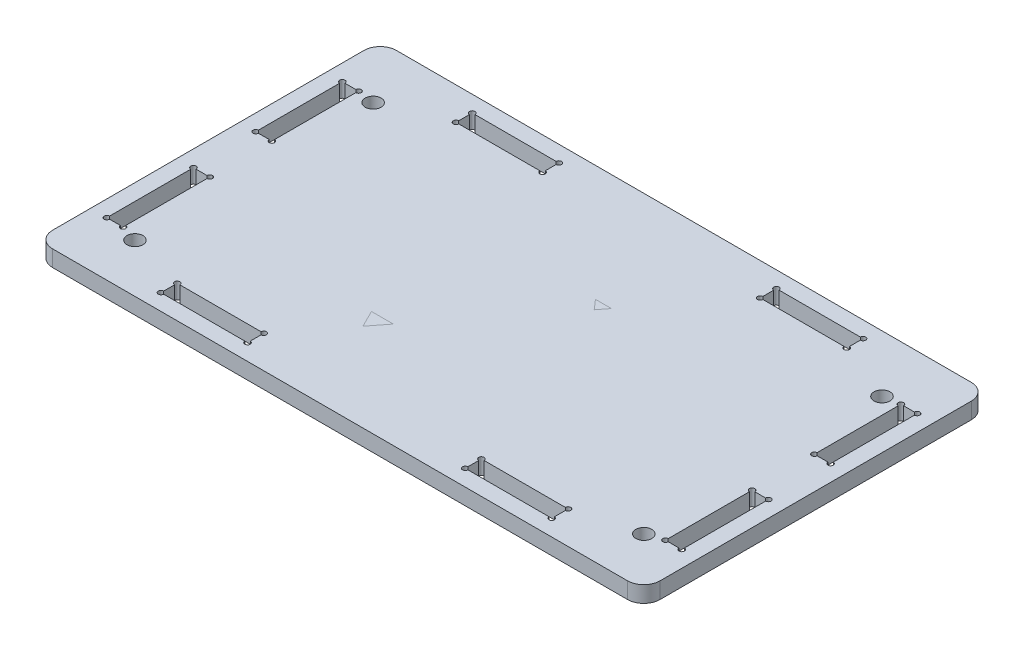
from build123d import *

# Parameters (mm, degrees)
SKETCH5_R              = 1.4732
BOSS_EXTRUDE1_DEPTH    = 3
SKETCH6_R              = 5
SKETCH6_R_2            = 3.5
BOSS_EXTRUDE2_DEPTH    = 0.2
SKETCH6_R_3            = 2
BOSS_EXTRUDE2_2_DEPTH  = 0.2
BOSS_EXTRUDE2_3_DEPTH  = 0.2
BOSS_EXTRUDE2_4_DEPTH  = 0.2
BOSS_EXTRUDE2_5_DEPTH  = 0.2
BOSS_EXTRUDE2_6_DEPTH  = 0.2
BOSS_EXTRUDE2_7_DEPTH  = 0.2
BOSS_EXTRUDE2_8_DEPTH  = 0.2
BOSS_EXTRUDE2_9_DEPTH  = 0.2
BOSS_EXTRUDE2_10_DEPTH = 0.2
BOSS_EXTRUDE2_11_DEPTH = 0.2
SKETCH6_W              = 7.5
SKETCH6_H              = 1.875
BOSS_EXTRUDE2_12_DEPTH = 0.2
BOSS_EXTRUDE2_13_DEPTH = 0.2
BOSS_EXTRUDE2_14_DEPTH = 0.2
BOSS_EXTRUDE2_15_DEPTH = 0.2
BOSS_EXTRUDE2_16_DEPTH = 0.2
BOSS_EXTRUDE2_17_DEPTH = 0.2
BOSS_EXTRUDE2_18_DEPTH = 0.2
BOSS_EXTRUDE2_19_DEPTH = 0.2
SKETCH6_H_2            = 7.5
BOSS_EXTRUDE2_20_DEPTH = 0.2


with BuildPart() as part:
    # Sketch5 → Boss-Extrude1 (new body)
    with BuildSketch(Plane(origin=(0, 0, 0), x_dir=(1, 0, 0), z_dir=(0, 1, 0))):
        with BuildLine():
            Line((-13.2, -6), (93, -6))
            ThreePointArc((93, -6), (95.121320344, -5.121320344), (96, -3))
            Line((96, -3), (96, 54.5))
            ThreePointArc((96, 54.5), (95.121320344, 56.621320344), (93, 57.5))
            Line((93, 57.5), (-13.2, 57.5))
            ThreePointArc((-13.2, 57.5), (-15.321320344, 56.621320344), (-16.2, 54.5))
            Line((-16.2, 54.5), (-16.2, -3))
            ThreePointArc((-16.2, -3), (-15.321320344, -5.121320344), (-13.2, -6))
        make_face()
        with Locations(Location((-7, 3, 0), (0, 0, 270))):
            Circle(SKETCH5_R, mode=Mode.SUBTRACT)
        with Locations(Location((-7, 47, 0), (0, 0, 270))):
            Circle(SKETCH5_R, mode=Mode.SUBTRACT)
        with Locations(Location((87, 47, 0), (0, 0, 270))):
            Circle(SKETCH5_R, mode=Mode.SUBTRACT)
        with Locations(Location((87, 3, 0), (0, 0, 270))):
            Circle(SKETCH5_R, mode=Mode.SUBTRACT)
        with BuildLine():
            Line((4.3, 54.5), (19.3, 54.5))
            ThreePointArc((19.3, 54.5), (20.153553391, 54.853553391), (19.8, 54))
            Line((19.8, 54), (19.8, 52))
            ThreePointArc((19.8, 52), (20.153553391, 51.146446609), (19.3, 51.5))
            Line((19.3, 51.5), (4.3, 51.5))
            ThreePointArc((4.3, 51.5), (3.446446609, 51.146446609), (3.8, 52))
            Line((3.8, 52), (3.8, 54))
            ThreePointArc((3.8, 54), (3.446446609, 54.853553391), (4.3, 54.5))
        make_face(mode=Mode.SUBTRACT)
        with BuildLine():
            Line((60.5, 54.5), (75.5, 54.5))
            ThreePointArc((75.5, 54.5), (76.353553391, 54.853553391), (76, 54))
            Line((76, 54), (76, 52))
            ThreePointArc((76, 52), (76.353553391, 51.146446609), (75.5, 51.5))
            Line((75.5, 51.5), (60.5, 51.5))
            ThreePointArc((60.5, 51.5), (59.646446609, 51.146446609), (60, 52))
            Line((60, 52), (60, 54))
            ThreePointArc((60, 54), (59.646446609, 54.853553391), (60.5, 54.5))
        make_face(mode=Mode.SUBTRACT)
        with BuildLine():
            Line((4.3, 0), (19.3, 0))
            ThreePointArc((19.3, 0), (20.153553391, 0.353553391), (19.8, -0.5))
            Line((19.8, -0.5), (19.8, -2.5))
            ThreePointArc((19.8, -2.5), (20.153553391, -3.353553391), (19.3, -3))
            Line((19.3, -3), (4.3, -3))
            ThreePointArc((4.3, -3), (3.446446609, -3.353553391), (3.8, -2.5))
            Line((3.8, -2.5), (3.8, -0.5))
            ThreePointArc((3.8, -0.5), (3.446446609, 0.353553391), (4.3, 0))
        make_face(mode=Mode.SUBTRACT)
        with BuildLine():
            Line((60.5, 0), (75.5, 0))
            ThreePointArc((75.5, 0), (76.353553391, 0.353553391), (76, -0.5))
            Line((76, -0.5), (76, -2.5))
            ThreePointArc((76, -2.5), (76.353553391, -3.353553391), (75.5, -3))
            Line((75.5, -3), (60.5, -3))
            ThreePointArc((60.5, -3), (59.646446609, -3.353553391), (60, -2.5))
            Line((60, -2.5), (60, -0.5))
            ThreePointArc((60, -0.5), (59.646446609, 0.353553391), (60.5, 0))
        make_face(mode=Mode.SUBTRACT)
        with BuildLine():
            Line((-13.2, 32), (-13.2, 47))
            ThreePointArc((-13.2, 47), (-13.553553391, 47.853553391), (-12.7, 47.5))
            Line((-12.7, 47.5), (-10.7, 47.5))
            ThreePointArc((-10.7, 47.5), (-9.846446609, 47.853553391), (-10.2, 47))
            Line((-10.2, 47), (-10.2, 32))
            ThreePointArc((-10.2, 32), (-9.846446609, 31.146446609), (-10.7, 31.5))
            Line((-10.7, 31.5), (-12.7, 31.5))
            ThreePointArc((-12.7, 31.5), (-13.553553391, 31.146446609), (-13.2, 32))
        make_face(mode=Mode.SUBTRACT)
        with BuildLine():
            Line((-13.2, 4.5), (-13.2, 19.5))
            ThreePointArc((-13.2, 19.5), (-13.553553391, 20.353553391), (-12.7, 20))
            Line((-12.7, 20), (-10.7, 20))
            ThreePointArc((-10.7, 20), (-9.846446609, 20.353553391), (-10.2, 19.5))
            Line((-10.2, 19.5), (-10.2, 4.5))
            ThreePointArc((-10.2, 4.5), (-9.846446609, 3.646446609), (-10.7, 4))
            Line((-10.7, 4), (-12.7, 4))
            ThreePointArc((-12.7, 4), (-13.553553391, 3.646446609), (-13.2, 4.5))
        make_face(mode=Mode.SUBTRACT)
        with BuildLine():
            Line((90, 32), (90, 47))
            ThreePointArc((90, 47), (89.646446609, 47.853553391), (90.5, 47.5))
            Line((90.5, 47.5), (92.5, 47.5))
            ThreePointArc((92.5, 47.5), (93.353553391, 47.853553391), (93, 47))
            Line((93, 47), (93, 32))
            ThreePointArc((93, 32), (93.353553391, 31.146446609), (92.5, 31.5))
            Line((92.5, 31.5), (90.5, 31.5))
            ThreePointArc((90.5, 31.5), (89.646446609, 31.146446609), (90, 32))
        make_face(mode=Mode.SUBTRACT)
        with BuildLine():
            Line((90, 4.5), (90, 19.5))
            ThreePointArc((90, 19.5), (89.646446609, 20.353553391), (90.5, 20))
            Line((90.5, 20), (92.5, 20))
            ThreePointArc((92.5, 20), (93.353553391, 20.353553391), (93, 19.5))
            Line((93, 19.5), (93, 4.5))
            ThreePointArc((93, 4.5), (93.353553391, 3.646446609), (92.5, 4))
            Line((92.5, 4), (90.5, 4))
            ThreePointArc((90.5, 4), (89.646446609, 3.646446609), (90, 4.5))
        make_face(mode=Mode.SUBTRACT)
    extrude(amount=BOSS_EXTRUDE1_DEPTH)


with BuildPart() as body_2:
    # Sketch6 → Boss-Extrude2 (new body)
    with BuildSketch(Plane(origin=(0, 3, 0), x_dir=(1, 0, 0), z_dir=(0, 1, 0))):
        with Locations(Location((70, 37.5, 0), (0, 0, 270))):
            Circle(SKETCH6_R)
        with Locations(Location((70, 37.5, 0), (0, 0, 270))):
            Circle(SKETCH6_R_2, mode=Mode.SUBTRACT)
    extrude(amount=-BOSS_EXTRUDE2_DEPTH)


with BuildPart() as body_3:
    # Sketch6 → Boss-Extrude2 2 (new body)
    with BuildSketch(Plane(origin=(0, 3, 0), x_dir=(1, 0, 0), z_dir=(0, 1, 0))):
        with Locations(Location((70, 37.5, 0), (0, 0, 270))):
            Circle(SKETCH6_R_3)
    extrude(amount=-BOSS_EXTRUDE2_2_DEPTH)


with BuildPart() as body_4:
    # Sketch6 → Boss-Extrude2 3 (new body)
    with BuildSketch(Plane(origin=(0, 3, 0), x_dir=(1, 0, 0), z_dir=(0, 1, 0))):
        with BuildLine():
            Line((72.759643105, 8.330543209), (73.173589571, 7.70512469))
            Line((73.173589571, 7.70512469), (71.094859602, 8.128068796))
            Line((71.094859602, 8.128068796), (71.517803708, 10.206798765))
            Line((71.517803708, 10.206798765), (71.931750173, 9.581380246))
            ThreePointArc((71.931750173, 9.581380246), (73.351504822, 13.50867013), (70, 16))
            Line((70, 16), (70, 17.5))
            ThreePointArc((70, 17.5), (74.787864031, 13.940957328), (72.759643105, 8.330543209))
        make_face()
    extrude(amount=-BOSS_EXTRUDE2_3_DEPTH)


with BuildPart() as body_5:
    # Sketch6 → Boss-Extrude2 4 (new body)
    with BuildSketch(Plane(origin=(0, 3, 0), x_dir=(1, 0, 0), z_dir=(0, 1, 0))):
        with BuildLine():
            Line((67.240356895, 16.669456791), (66.826410429, 17.29487531))
            Line((66.826410429, 17.29487531), (68.905140398, 16.871931204))
            Line((68.905140398, 16.871931204), (68.482196292, 14.793201235))
            Line((68.482196292, 14.793201235), (68.068249827, 15.418619754))
            ThreePointArc((68.068249827, 15.418619754), (66.648495178, 11.49132987), (70, 9))
            Line((70, 9), (70, 7.5))
            ThreePointArc((70, 7.5), (65.212135969, 11.059042672), (67.240356895, 16.669456791))
        make_face()
    extrude(amount=-BOSS_EXTRUDE2_4_DEPTH)


with BuildPart() as body_6:
    # Sketch6 → Boss-Extrude2 5 (new body)
    with BuildSketch(Plane(origin=(0, 3, 0), x_dir=(1, 0, 0), z_dir=(0, 1, 0))):
        Polygon((55, 36.062704137), (52, 32.64), (52, 30.64), (48, 30.64), (48, 32.64), (45, 36.062704137), align=None)
    extrude(amount=-BOSS_EXTRUDE2_5_DEPTH)


with BuildPart() as body_7:
    # Sketch6 → Boss-Extrude2 6 (new body)
    with BuildSketch(Plane(origin=(0, 3, 0), x_dir=(1, 0, 0), z_dir=(0, 1, 0))):
        with BuildLine():
            ThreePointArc((47.65, 37.497071421), (47.642928579, 36.79), (48.35, 36.782928579))
            ThreePointArc((48.35, 36.782928579), (50.003829046, 37.494466561), (51.65, 36.765386314))
            ThreePointArc((51.65, 36.765386314), (52.357071421, 36.772457735), (52.35, 37.479529156))
            ThreePointArc((52.35, 37.479529156), (50.003751117, 38.493315991), (47.65, 37.497071421))
        make_face()
    extrude(amount=-BOSS_EXTRUDE2_6_DEPTH)


with BuildPart() as body_8:
    # Sketch6 → Boss-Extrude2 7 (new body)
    with BuildSketch(Plane(origin=(0, 3, 0), x_dir=(1, 0, 0), z_dir=(0, 1, 0))):
        with BuildLine():
            ThreePointArc((46.65, 39.997071421), (46.642928579, 39.29), (47.35, 39.282928579))
            ThreePointArc((47.35, 39.282928579), (50.003629954, 40.370866104), (52.65, 39.265386314))
            ThreePointArc((52.65, 39.265386314), (53.357071421, 39.272457735), (53.35, 39.979529156))
            ThreePointArc((53.35, 39.979529156), (50.003619768, 41.370815325), (46.65, 39.997071421))
        make_face()
    extrude(amount=-BOSS_EXTRUDE2_7_DEPTH)


with BuildPart() as body_9:
    # Sketch6 → Boss-Extrude2 8 (new body)
    with BuildSketch(Plane(origin=(0, 3, 0), x_dir=(1, 0, 0), z_dir=(0, 1, 0))):
        with BuildLine():
            ThreePointArc((45.65, 42.497071421), (50.003765563, 44.355812607), (54.35, 42.479529156))
            ThreePointArc((54.35, 42.479529156), (54.357071421, 41.772457735), (53.65, 41.765386314))
            ThreePointArc((53.65, 41.765386314), (50.003803478, 43.356928408), (46.35, 41.782928579))
            ThreePointArc((46.35, 41.782928579), (45.642928579, 41.79), (45.65, 42.497071421))
        make_face()
    extrude(amount=-BOSS_EXTRUDE2_8_DEPTH)


with BuildPart() as body_10:
    # Sketch6 → Boss-Extrude2 9 (new body)
    with BuildSketch(Plane(origin=(0, 3, 0), x_dir=(1, 0, 0), z_dir=(0, 1, 0))):
        Polygon((55, 13.922704137), (52, 10.5), (52, 8.5), (48, 8.5), (48, 10.5), (45, 13.922704137), align=None)
    extrude(amount=-BOSS_EXTRUDE2_9_DEPTH)


with BuildPart() as body_11:
    # Sketch6 → Boss-Extrude2 10 (new body)
    with BuildSketch(Plane(origin=(0, 3, 0), x_dir=(1, 0, 0), z_dir=(0, 1, 0))):
        with BuildLine():
            ThreePointArc((47.65, 15.357071421), (47.642928579, 14.65), (48.35, 14.642928579))
            ThreePointArc((48.35, 14.642928579), (50.003829046, 15.354466561), (51.65, 14.625386314))
            ThreePointArc((51.65, 14.625386314), (52.357071421, 14.632457735), (52.35, 15.339529156))
            ThreePointArc((52.35, 15.339529156), (50.003751117, 16.353315991), (47.65, 15.357071421))
        make_face()
    extrude(amount=-BOSS_EXTRUDE2_10_DEPTH)


with BuildPart() as body_12:
    # Sketch6 → Boss-Extrude2 11 (new body)
    with BuildSketch(Plane(origin=(0, 3, 0), x_dir=(1, 0, 0), z_dir=(0, 1, 0))):
        Polygon((33.75, 36.5625), (30, 44.0625), (26.25, 36.5625), align=None)
    extrude(amount=-BOSS_EXTRUDE2_11_DEPTH)


with BuildPart() as body_13:
    # Sketch6 → Boss-Extrude2 12 (new body)
    with BuildSketch(Plane(origin=(0, 3, 0), x_dir=(1, 0, 0), z_dir=(0, 1, 0))):
        with Locations((30, 45)):
            Rectangle(SKETCH6_W, SKETCH6_H)
    extrude(amount=-BOSS_EXTRUDE2_12_DEPTH)


with BuildPart() as body_14:
    # Sketch6 → Boss-Extrude2 13 (new body)
    with BuildSketch(Plane(origin=(0, 3, 0), x_dir=(1, 0, 0), z_dir=(0, 1, 0))):
        Polygon((30, 36.5625), (33.75, 29.0625), (26.25, 29.0625), align=None)
    extrude(amount=-BOSS_EXTRUDE2_13_DEPTH)


with BuildPart() as body_15:
    # Sketch6 → Boss-Extrude2 14 (new body)
    with BuildSketch(Plane(origin=(0, 3, 0), x_dir=(1, 0, 0), z_dir=(0, 1, 0))):
        Polygon((30.000000304, 13.4375), (26.25, 20.937500152), (33.75, 20.937499848), align=None)
    extrude(amount=-BOSS_EXTRUDE2_14_DEPTH)


with BuildPart() as body_16:
    # Sketch6 → Boss-Extrude2 15 (new body)
    with BuildSketch(Plane(origin=(0, 3, 0), x_dir=(1, 0, 0), z_dir=(0, 1, 0))):
        Polygon((26.25, 13.437500152), (30, 5.9375), (33.75, 13.437499848), align=None)
    extrude(amount=-BOSS_EXTRUDE2_15_DEPTH)


with BuildPart() as body_17:
    # Sketch6 → Boss-Extrude2 16 (new body)
    with BuildSketch(Plane(origin=(0, 3, 0), x_dir=(1, 0, 0), z_dir=(0, 1, 0))):
        with Locations((30, 5)):
            Rectangle(SKETCH6_W, SKETCH6_H)
    extrude(amount=-BOSS_EXTRUDE2_16_DEPTH)


with BuildPart() as body_18:
    # Sketch6 → Boss-Extrude2 17 (new body)
    with BuildSketch(Plane(origin=(0, 3, 0), x_dir=(1, 0, 0), z_dir=(0, 1, 0))):
        Polygon((10, 11.5625), (13.75, 4.0625), (6.25, 4.0625), align=None)
    extrude(amount=-BOSS_EXTRUDE2_17_DEPTH)


with BuildPart() as body_19:
    # Sketch6 → Boss-Extrude2 18 (new body)
    with BuildSketch(Plane(origin=(0, 3, 0), x_dir=(1, 0, 0), z_dir=(0, 1, 0))):
        with Locations((10, 16.25)):
            Rectangle(SKETCH6_W, SKETCH6_H)
    extrude(amount=-BOSS_EXTRUDE2_18_DEPTH)


with BuildPart() as body_20:
    # Sketch6 → Boss-Extrude2 19 (new body)
    with BuildSketch(Plane(origin=(0, 3, 0), x_dir=(1, 0, 0), z_dir=(0, 1, 0))):
        with Locations((10, 20)):
            Rectangle(SKETCH6_W, SKETCH6_H)
    extrude(amount=-BOSS_EXTRUDE2_19_DEPTH)


with BuildPart() as body_21:
    # Sketch6 → Boss-Extrude2 20 (new body)
    with BuildSketch(Plane(origin=(0, 3, 0), x_dir=(1, 0, 0), z_dir=(0, 1, 0))):
        with Locations((10, 37.5)):
            Rectangle(SKETCH6_W, SKETCH6_H_2)
    extrude(amount=-BOSS_EXTRUDE2_20_DEPTH)


solid = Compound([part.part, body_2.part, body_3.part, body_4.part, body_5.part, body_6.part, body_7.part, body_8.part, body_9.part, body_10.part, body_11.part, body_12.part, body_13.part, body_14.part, body_15.part, body_16.part, body_17.part, body_18.part, body_19.part, body_20.part, body_21.part])
